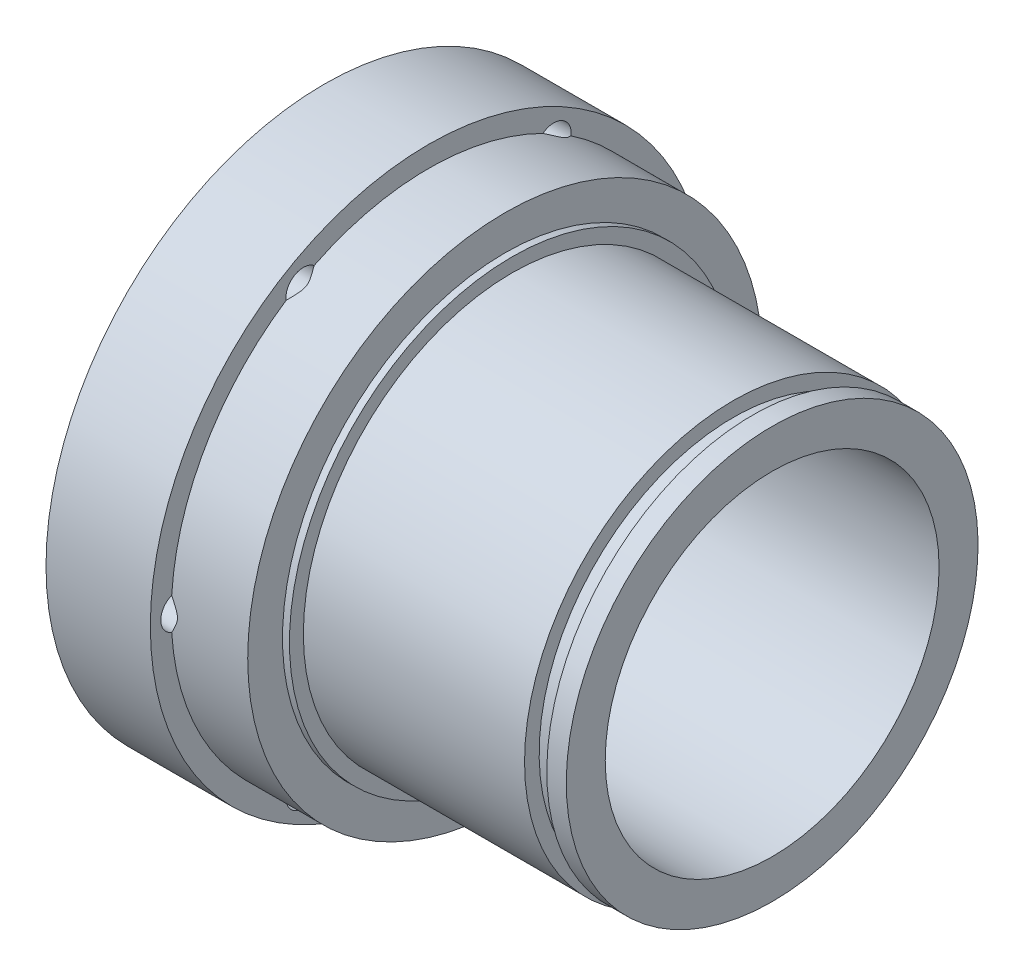
from build123d import *

# Parameters (mm, degrees)
CIRPATTERN1_COUNT = 6


with BuildPart() as part:
    # Sketch1 → Revolve1 (revolve)
    with BuildSketch(Plane.XY, mode=Mode.PRIVATE) as revolve1_sk:
        Polygon((0, 16), (0, 20), (7.5, 20), (7.5, 18.5), (13, 18.5), (13, 16), (13.5, 16), (13.5, 15), (29.4, 15), (29.4, 13.95), (30.8, 13.95), (30.8, 14.8), (32.2, 14.8), (32.2, 12), (7, 12), (7, 15), (6.5, 15), (6.5, 16), align=None)
    revolve(revolve1_sk.sketch.rotate(Axis((-3.70841034, 0, 0), (1, 0, 0)), 180), axis=Axis((-3.70841034, 0, 0), (1, 0, 0)))

    # Sketch4 → M3 Tapped Hole1 (revolve, cut)
    with BuildSketch(Plane(origin=(0, 0, 18), x_dir=(0, 0, 1), z_dir=(0, 1, 0))):
        Polygon((0, 0), (0, 8.251075774), (1.25, 7.5), (1.25, 0), align=None)
    m3_tapped_hole1 = revolve(axis=Axis((-6.35, 0, 18), (1, 0, 0)), mode=Mode.SUBTRACT)

    # CirPattern1: M3 Tapped Hole1 ×6 about axis
    cirpattern1_axis = Axis((0, 0, 0), (1, 0, 0))
    for i in range(1, CIRPATTERN1_COUNT):
        add(m3_tapped_hole1.rotate(cirpattern1_axis, i * 360 / CIRPATTERN1_COUNT), mode=Mode.SUBTRACT)


solid = part.part
